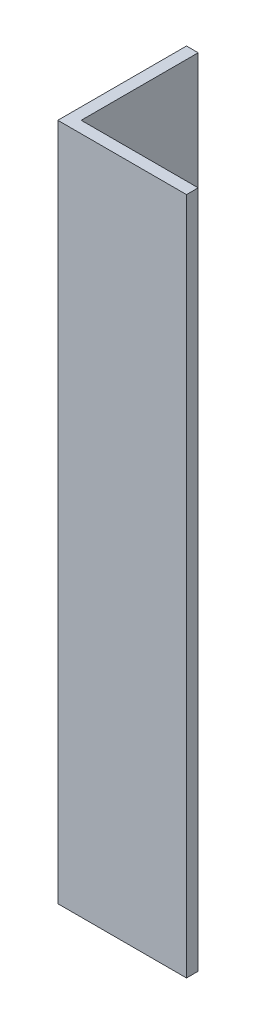
from build123d import *

# Parameters (mm, degrees)
EXTRUDE_1_DEPTH = 116


with BuildPart() as part:
    # Эскиз1 → Вытянуть1 (new body)
    with BuildSketch(Plane(origin=(0, 0, 0), x_dir=(1, 0, 0), z_dir=(0, 1, 0))):
        Polygon((0, -1.071873395), (0, -21.071873395), (20, -21.071873395), (20, -23.071873395), (-2, -23.071873395), (-2, -1.071873395), align=None)
    extrude(amount=EXTRUDE_1_DEPTH)


solid = part.part
